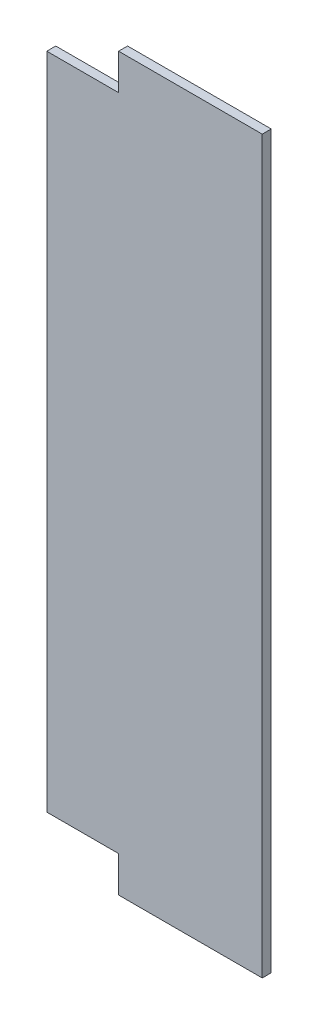
from build123d import *

# Parameters (mm, degrees)
BOSS_EXTRUDE1_DEPTH = 1.5875


with BuildPart() as part:
    # Sketch3 → Boss-Extrude1 (new, symmetric)
    with BuildSketch(Plane.XY):
        Polygon((25.4, 129.2225), (76.2, 129.2225), (76.2, -129.2225), (25.4, -129.2225), (25.4, -116.5225), (0, -116.5225), (0, 116.5225), (25.4, 116.5225), align=None)
    extrude(amount=BOSS_EXTRUDE1_DEPTH, both=True)


solid = part.part
